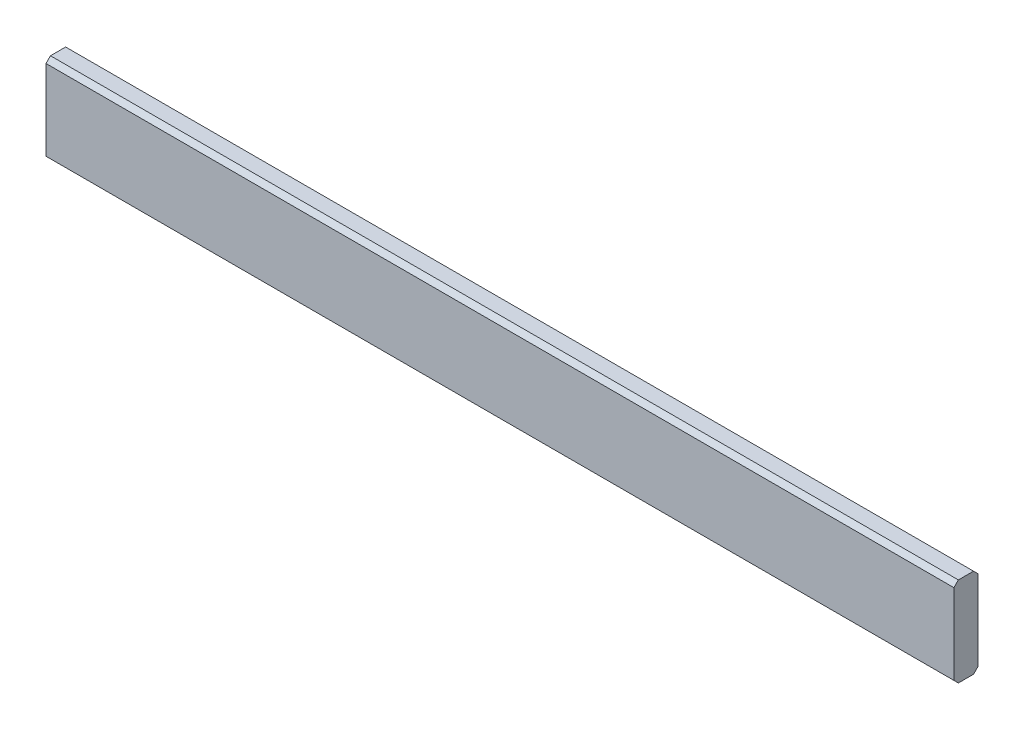
from build123d import *

# Parameters (mm, degrees)
ESQUISSE1_W        = 1017
ESQUISSE1_H        = 100
BOSS_EXTRU_1_DEPTH = 27
CHANFREIN1_SIZE    = 5


with BuildPart() as part:
    # Esquisse1 → Boss.-Extru.1 (new body)
    with BuildSketch(Plane.XY):
        with Locations((508.5, 50)):
            Rectangle(ESQUISSE1_W, ESQUISSE1_H)
    extrude(amount=BOSS_EXTRU_1_DEPTH)

    # Chanfrein1
    chanfrein1_edges = [part.edges().sort_by_distance(p)[0] for p in [
        (508.5, 100, 27),
        (508.5, 100, 0),
        (508.5, 0, 0),
        (508.5, 0, 27),
    ]]
    chamfer(chanfrein1_edges, length=CHANFREIN1_SIZE)


solid = part.part
